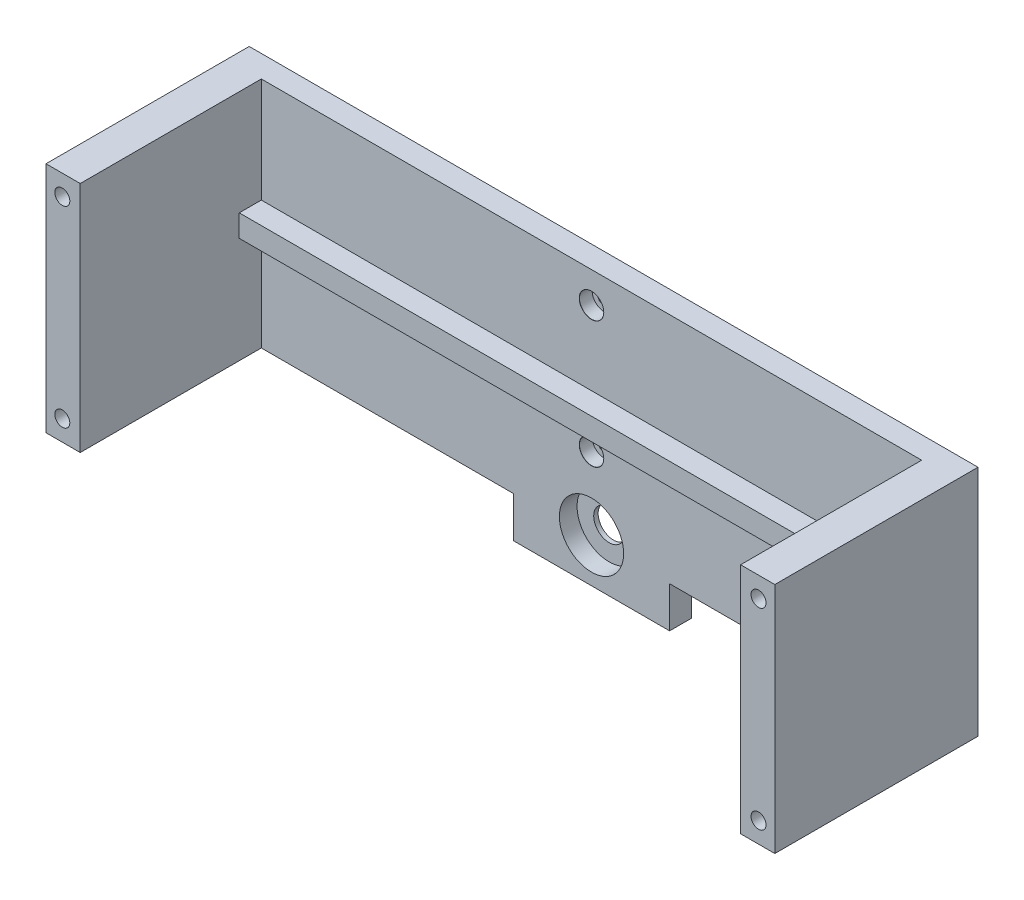
from build123d import *

# Parameters (mm, degrees)
ESQUISSE1_W                                        = 165
ESQUISSE1_H                                        = 52.75
BOSS_EXTRU_1_DEPTH                                 = 5
BOSS_EXTRU_2_DEPTH                                 = 41
ESQUISSE3_W                                        = 149.5
ESQUISSE3_H                                        = 5
ENL_V_MAT_EXTRU_1_DEPTH                            = 36
D_GAGEMENT_M31_D                                   = 3.4
D_GAGEMENT_M31_DEPTH                               = 6
D_GAGEMENT_M31_TIP                                 = 1.021463052
CHAMBRAGE_POUR_VIS_SIX_PANS_CREUX_2_COUNT          = 2
CHAMBRAGE_POUR_VIS_SIX_PANS_CREUX_2_PITCH          = 28.7
SKETCH7_W                                          = 35.36
SKETCH7_H                                          = 5
BOSS_EXTRUDE1_DEPTH                                = 9.25
CHAMBRAGE_POUR_VIS_T_TE_HEXAGONALE_M61_D           = 7
CHAMBRAGE_POUR_VIS_T_TE_HEXAGONALE_M61_CBORE_D     = 14.547
CHAMBRAGE_POUR_VIS_T_TE_HEXAGONALE_M61_CBORE_DEPTH = 4


with BuildPart() as part:
    # Esquisse1 → Boss.-Extru.1 (new body)
    with BuildSketch(Plane.XY):
        with Locations((51.592169311, -5.600810811)):
            Rectangle(ESQUISSE1_W, ESQUISSE1_H)
    extrude(amount=BOSS_EXTRU_1_DEPTH)

    # Esquisse2 → Boss.-Extru.2 (add)
    with BuildSketch(Plane.XY.offset(5)):
        Polygon((-30.907830689, 20.774189189), (-23.157830689, 20.774189189), (-23.157830689, -2.975810811), (126.342169311, -2.975810811), (126.342169311, 20.774189189), (134.092169311, 20.774189189), (134.092169311, -31.975810811), (126.342169311, -31.975810811), (126.342169311, -7.975810811), (-23.157830689, -7.975810811), (-23.157830689, -31.975810811), (-30.907830689, -31.975810811), align=None)
    extrude(amount=BOSS_EXTRU_2_DEPTH)

    # Esquisse3 → Enlèv. mat.-Extru.1 (cut)
    with BuildSketch(Plane.XY.offset(46)):
        with Locations((51.592169311, -5.475810811)):
            Rectangle(ESQUISSE3_W, ESQUISSE3_H)
    extrude(amount=-ENL_V_MAT_EXTRU_1_DEPTH, mode=Mode.SUBTRACT)

    # Dégagement M31
    with Locations(Plane.XY.offset(46)):
        with Locations((-27.220932929, 16.149189189), (130.405271551, 16.149189189), (130.405271551, -27.350810811), (-27.220932929, -27.350810811)):
            Hole(D_GAGEMENT_M31_D / 2, depth=D_GAGEMENT_M31_DEPTH)
            with Locations((0, 0, -(D_GAGEMENT_M31_DEPTH + D_GAGEMENT_M31_TIP / 2))):  # 118° drill point
                Cone(0, D_GAGEMENT_M31_D / 2, D_GAGEMENT_M31_TIP, mode=Mode.SUBTRACT)

    # Sketch5 → Chambrage pour vis à six pans creux M2.51 (revolve, cut)
    with BuildSketch(Plane(origin=(51.592169311, 13.774189189, 5), x_dir=(0, -1, 0), z_dir=(1, 0, 0))):
        Polygon((0, 0), (0, 5), (1.55, 5), (1.55, 2.9), (2.75, 2.9), (2.75, 0.025), (2.775, 0), align=None)
    chambrage_pour_vis_six_pans_creux_m2_5 = revolve(axis=Axis((51.592169311, 13.774189189, 11.35), (0, 0, -1)), mode=Mode.SUBTRACT)

    # Chambrage pour vis _ six pans creux  2: Chambrage pour vis à six pans creux M2.51 ×2
    with Locations(*[(0, -i * CHAMBRAGE_POUR_VIS_SIX_PANS_CREUX_2_PITCH, 0) for i in range(1, CHAMBRAGE_POUR_VIS_SIX_PANS_CREUX_2_COUNT)]):
        add(chambrage_pour_vis_six_pans_creux_m2_5, mode=Mode.SUBTRACT)

    # Sketch7 → Boss-Extrude1 (add)
    with BuildSketch(Plane.XZ.offset(31.975810811)):
        with Locations((51.592169311, 2.5)):
            Rectangle(SKETCH7_W, SKETCH7_H)
    extrude(amount=BOSS_EXTRUDE1_DEPTH)

    # Chambrage pour vis à tête hexagonale M61 (through all)
    with Locations(Plane.XY.offset(5)):
        with Locations((51.592169311, -31.275810811)):
            CounterBoreHole(CHAMBRAGE_POUR_VIS_T_TE_HEXAGONALE_M61_D / 2, CHAMBRAGE_POUR_VIS_T_TE_HEXAGONALE_M61_CBORE_D / 2, CHAMBRAGE_POUR_VIS_T_TE_HEXAGONALE_M61_CBORE_DEPTH)


solid = part.part
